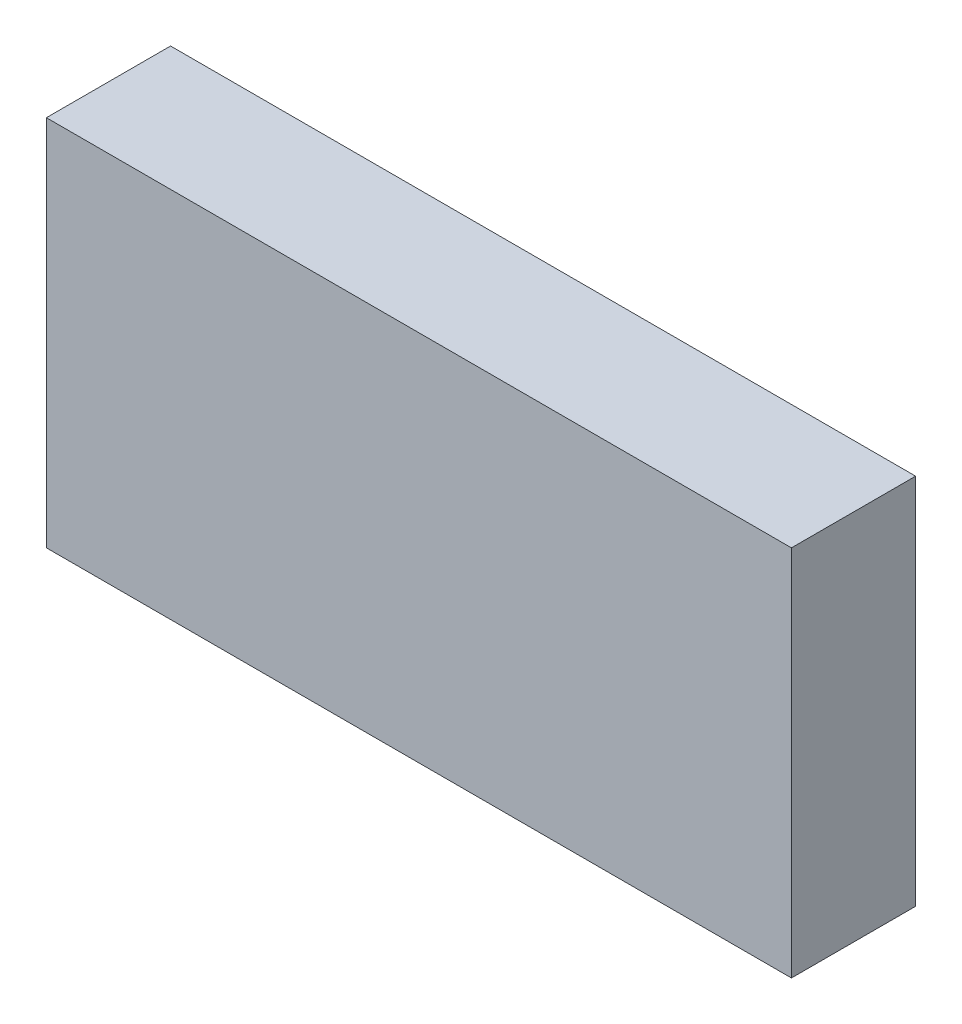
from build123d import *

# Parameters (mm, degrees)
SKETCH1_W     = 12
SKETCH1_H     = 6
PROFILE_DEPTH = 2


with BuildPart() as part:
    # Sketch1 → Profile (new body)
    with BuildSketch(Plane.XY):
        with Locations((6, 3)):
            Rectangle(SKETCH1_W, SKETCH1_H)
    extrude(amount=PROFILE_DEPTH)


solid = part.part
